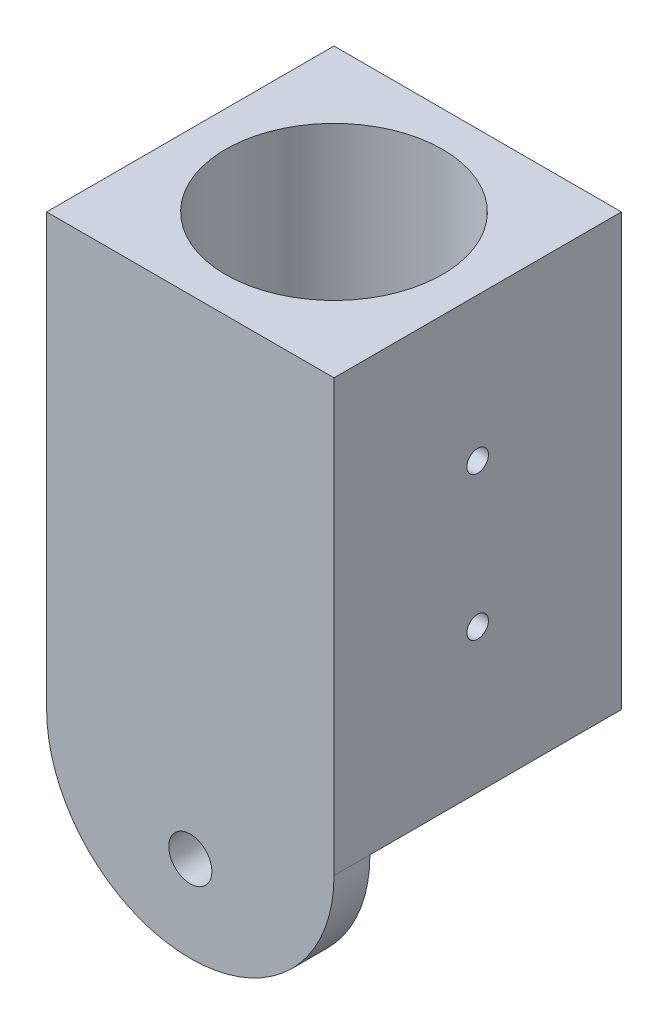
from build123d import *

# Parameters (mm, degrees)
SKETCH_1_W             = 40
SKETCH_1_H             = 40
EXTRUDE_1_DEPTH        = 60
SKETCH_2_R             = 15.1
CUT_EXTRUDE_1_DEPTH    = 50
SKETCH_3_R             = 3
EXTRUDE_2_DEPTH        = 5
SKETCH_4_R             = 1.5
CUT_EXTRUDE_2_DEPTH    = 75.833147735
PATTERN_LINEAR_1_COUNT = 2
PATTERN_LINEAR_1_PITCH = 20


with BuildPart() as part:
    # 草圖1 → 填料-伸長1 (new body)
    with BuildSketch(Plane(origin=(0, 0, 0), x_dir=(1, 0, 0), z_dir=(0, 1, 0))):
        Rectangle(SKETCH_1_W, SKETCH_1_H)
    extrude(amount=EXTRUDE_1_DEPTH)

    # 草圖2 → 除料-伸長1 (cut)
    with BuildSketch(Plane(origin=(0, 60, 0), x_dir=(1, 0, 0), z_dir=(0, 1, 0))):
        with Locations(Location((0, 0, 0), (0, 0, 270))):
            Circle(SKETCH_2_R)
    extrude(amount=-CUT_EXTRUDE_1_DEPTH, mode=Mode.SUBTRACT)

    # 草圖3 → 填料-伸長2 (add)
    with BuildSketch(Plane.XY.offset(20)):
        with BuildLine():
            Line((-20, 0), (20, 0))
            ThreePointArc((20, 0), (0, -20), (-20, 0))
        make_face()
        with Locations((0, -8)):
            Circle(SKETCH_3_R, mode=Mode.SUBTRACT)
    extrude(amount=-EXTRUDE_2_DEPTH)

    # 草圖4 → 除料-伸長2 (cut, through all)
    with BuildSketch(Plane(origin=(20, 0, 0), x_dir=(0, 0, -1), z_dir=(1, 0, 0))):
        with Locations((0, 20)):
            Circle(SKETCH_4_R)
    cut_extrude_2 = extrude(amount=-CUT_EXTRUDE_2_DEPTH, mode=Mode.SUBTRACT)

    # 直線複製排列1: 除料-伸長2 ×2
    with Locations(*[(0, i * PATTERN_LINEAR_1_PITCH, 0) for i in range(1, PATTERN_LINEAR_1_COUNT)]):
        add(cut_extrude_2, mode=Mode.SUBTRACT)


solid = part.part
